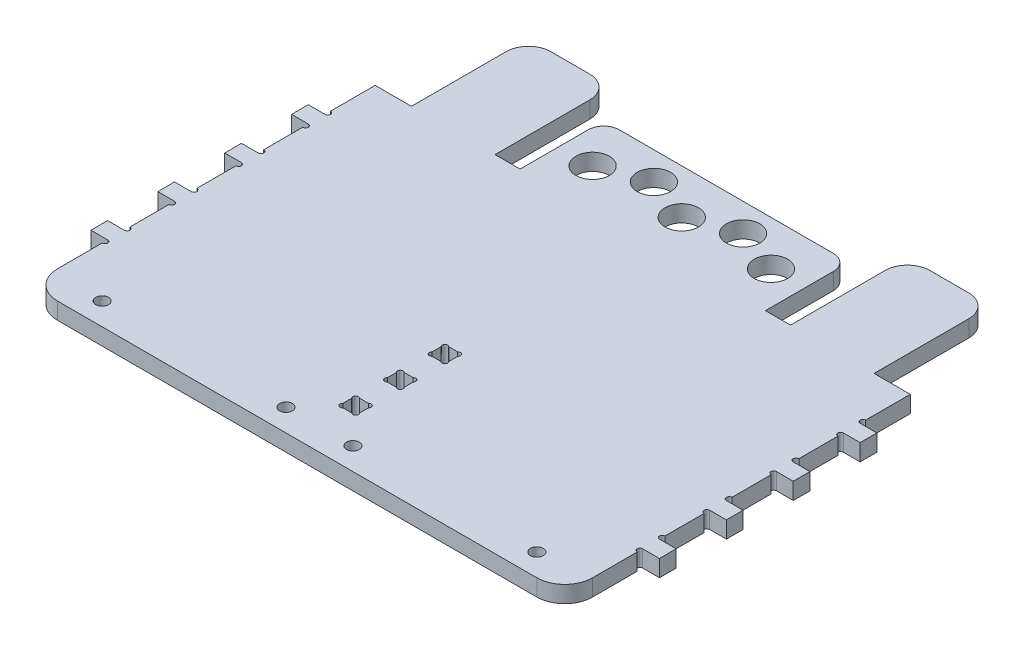
from build123d import *

# Parameters (mm, degrees)
SKETCH_S_R              = 7.3025
SKETCH_S_R_2            = 19.05
BOSS_EXTRUDE1_DEPTH     = 19.05
FILLET1_R               = 31.75
CUT_EXTRUDE1_DEPTH      = 778.557435178
CUT_EXTRUDE1_DEPTH_BACK = 778.557435178
SKETCH4_W               = 41.275
SKETCH4_H               = 19.05
SKETCH4_W_2             = 57.15
SKETCH4_W_3             = 28.575
CUT_EXTRUDE2_DEPTH      = 19.05
SKETCH5_W               = 95.25
SKETCH5_H               = 19.05
BOSS_EXTRUDE2_DEPTH     = 133.35
FILLET2_R               = 25.4


with BuildPart() as part:
    # Sketch s → Boss-Extrude1 (new body)
    with BuildSketch(Plane(origin=(0, 0, 0), x_dir=(1, 0, 0), z_dir=(0, 1, 0))):
        with BuildLine():
            Line((0, 50.8), (0, 0))
            Line((0, 0), (0, -31.75))
            Line((0, -31.75), (609.6, -31.75))
            Line((609.6, -31.75), (609.6, 0))
            Line((609.6, 0), (609.6, 50.8))
            ThreePointArc((609.6, 50.8), (606.425, 53.975), (609.6, 57.15))
            Line((609.6, 57.15), (628.65, 57.15))
            Line((628.65, 57.15), (628.65, 76.2))
            Line((628.65, 76.2), (609.6, 76.2))
            ThreePointArc((609.6, 76.2), (606.425, 79.375), (609.6, 82.55))
            Line((609.6, 82.55), (609.6, 127))
            ThreePointArc((609.6, 127), (606.425, 130.175), (609.6, 133.35))
            Line((609.6, 133.35), (628.65, 133.35))
            Line((628.65, 133.35), (628.65, 152.4))
            Line((628.65, 152.4), (609.6, 152.4))
            ThreePointArc((609.6, 152.4), (606.425, 155.575), (609.6, 158.75))
            Line((609.6, 158.75), (609.6, 203.2))
            ThreePointArc((609.6, 203.2), (606.425, 206.375), (609.6, 209.55))
            Line((609.6, 209.55), (628.65, 209.55))
            Line((628.65, 209.55), (628.65, 228.6))
            Line((628.65, 228.6), (609.6, 228.6))
            ThreePointArc((609.6, 228.6), (606.425, 231.775), (609.6, 234.95))
            Line((609.6, 234.95), (609.6, 279.4))
            ThreePointArc((609.6, 279.4), (606.425, 282.575), (609.6, 285.75))
            Line((609.6, 285.75), (628.65, 285.75))
            Line((628.65, 285.75), (628.65, 304.8))
            Line((628.65, 304.8), (609.6, 304.8))
            ThreePointArc((609.6, 304.8), (606.425, 307.975), (609.6, 311.15))
            Line((609.6, 311.15), (609.6, 381))
            Line((609.6, 381), (444.5, 381))
            Line((444.5, 381), (444.5, 439.42))
            ThreePointArc((444.5, 439.42), (439.292358569, 451.992358569), (426.72, 457.2))
            Line((426.72, 457.2), (304.8, 457.2))
            Line((304.8, 457.2), (182.88, 457.2))
            ThreePointArc((182.88, 457.2), (170.307641431, 451.992358569), (165.1, 439.42))
            Line((165.1, 439.42), (165.1, 381))
            Line((165.1, 381), (0, 381))
            Line((0, 381), (0, 311.15))
            ThreePointArc((0, 311.15), (3.175, 307.975), (0, 304.8))
            Line((0, 304.8), (-19.05, 304.8))
            Line((-19.05, 304.8), (-19.05, 285.75))
            Line((-19.05, 285.75), (0, 285.75))
            ThreePointArc((0, 285.75), (3.175, 282.575), (0, 279.4))
            Line((0, 279.4), (0, 234.95))
            ThreePointArc((0, 234.95), (3.175, 231.775), (0, 228.6))
            Line((0, 228.6), (-19.05, 228.6))
            Line((-19.05, 228.6), (-19.05, 209.55))
            Line((-19.05, 209.55), (0, 209.55))
            ThreePointArc((0, 209.55), (3.175, 206.375), (0, 203.2))
            Line((0, 203.2), (0, 158.75))
            ThreePointArc((0, 158.75), (3.175, 155.575), (0, 152.4))
            Line((0, 152.4), (-19.05, 152.4))
            Line((-19.05, 152.4), (-19.05, 133.35))
            Line((-19.05, 133.35), (0, 133.35))
            ThreePointArc((0, 133.35), (3.175, 130.175), (0, 127))
            Line((0, 127), (0, 82.55))
            ThreePointArc((0, 82.55), (3.175, 79.375), (0, 76.2))
            Line((0, 76.2), (-19.05, 76.2))
            Line((-19.05, 76.2), (-19.05, 57.15))
            Line((-19.05, 57.15), (0, 57.15))
            ThreePointArc((0, 57.15), (3.175, 53.975), (0, 50.8))
        make_face()
        with Locations(Location((57.15, -6.35, 0), (0, 0, 90))):
            Circle(SKETCH_S_R, mode=Mode.SUBTRACT)
        with Locations(Location((266.7, -6.35, 0), (0, 0, 90))):
            Circle(SKETCH_S_R, mode=Mode.SUBTRACT)
        with Locations(Location((342.9, -6.35, 0), (0, 0, 90))):
            Circle(SKETCH_S_R, mode=Mode.SUBTRACT)
        with Locations(Location((552.45, -6.35, 0), (0, 0, 90))):
            Circle(SKETCH_S_R, mode=Mode.SUBTRACT)
        with Locations(Location((203.2, 406.4, 0), (0, 0, 90))):
            Circle(SKETCH_S_R_2, mode=Mode.SUBTRACT)
        with Locations(Location((254, 425.45, 0), (0, 0, 90))):
            Circle(SKETCH_S_R_2, mode=Mode.SUBTRACT)
        with Locations(Location((304.8, 406.4, 0), (0, 0, 90))):
            Circle(SKETCH_S_R_2, mode=Mode.SUBTRACT)
        with Locations(Location((355.6, 425.45, 0), (0, 0, 90))):
            Circle(SKETCH_S_R_2, mode=Mode.SUBTRACT)
        with Locations(Location((406.4, 406.4, 0), (0, 0, 90))):
            Circle(SKETCH_S_R_2, mode=Mode.SUBTRACT)
    extrude(amount=BOSS_EXTRUDE1_DEPTH)

    # Fillet1
    fillet1_edges = [part.edges().sort_by_distance(p)[0] for p in [
        (609.6, 9.525, 31.75),
        (0, 9.525, 31.75),
    ]]
    fillet(fillet1_edges, radius=FILLET1_R)

    # Sketch3 → Cut-Extrude1 (cut, two sides: drawn at the far end of the back side and taken through both)
    with BuildSketch(Plane(origin=(0, 19.05, 0), x_dir=(1, 0, 0), z_dir=(0, 1, 0)).offset(-CUT_EXTRUDE1_DEPTH_BACK)):
        with BuildLine():
            Line((314.325, 131.490128061), (314.325, 141.559871939))
            ThreePointArc((314.325, 141.559871939), (314.325, 146.05), (309.834871939, 146.05))
            Line((309.834871939, 146.05), (299.765128061, 146.05))
            ThreePointArc((299.765128061, 146.05), (295.275, 146.05), (295.275, 141.559871939))
            Line((295.275, 141.559871939), (295.275, 131.490128061))
            ThreePointArc((295.275, 131.490128061), (295.275, 127), (299.765128061, 127))
            Line((299.765128061, 127), (309.834871939, 127))
            ThreePointArc((309.834871939, 127), (314.325, 127), (314.325, 131.490128061))
        make_face()
        with BuildLine():
            Line((314.325, 80.690128061), (314.325, 90.759871939))
            ThreePointArc((314.325, 90.759871939), (314.325, 95.25), (309.834871939, 95.25))
            Line((309.834871939, 95.25), (299.765128061, 95.25))
            ThreePointArc((299.765128061, 95.25), (295.275, 95.25), (295.275, 90.759871939))
            Line((295.275, 90.759871939), (295.275, 80.690128061))
            ThreePointArc((295.275, 80.690128061), (295.275, 76.2), (299.765128061, 76.2))
            Line((299.765128061, 76.2), (309.834871939, 76.2))
            ThreePointArc((309.834871939, 76.2), (314.325, 76.2), (314.325, 80.690128061))
        make_face()
        with BuildLine():
            Line((314.325, 29.890128061), (314.325, 39.959871939))
            ThreePointArc((314.325, 39.959871939), (314.325, 44.45), (309.834871939, 44.45))
            Line((309.834871939, 44.45), (299.765128061, 44.45))
            ThreePointArc((299.765128061, 44.45), (295.275, 44.45), (295.275, 39.959871939))
            Line((295.275, 39.959871939), (295.275, 29.890128061))
            ThreePointArc((295.275, 29.890128061), (295.275, 25.4), (299.765128061, 25.4))
            Line((299.765128061, 25.4), (309.834871939, 25.4))
            ThreePointArc((309.834871939, 25.4), (314.325, 25.4), (314.325, 29.890128061))
        make_face()
    extrude(amount=CUT_EXTRUDE1_DEPTH + CUT_EXTRUDE1_DEPTH_BACK, mode=Mode.SUBTRACT)

    # Sketch4 → Cut-Extrude2 (cut)
    with BuildSketch(Plane(origin=(0, 19.05, 0), x_dir=(1, 0, 0), z_dir=(0, 1, 0))):
        with Locations((20.6375, 371.475)):
            Rectangle(SKETCH4_W, SKETCH4_H)
        with Locations((88.9, 371.475)):
            Rectangle(SKETCH4_W_2, SKETCH4_H)
        with Locations((150.8125, 371.475)):
            Rectangle(SKETCH4_W_3, SKETCH4_H)
        with Locations((458.7875, 371.475)):
            Rectangle(SKETCH4_W_3, SKETCH4_H)
        with Locations((520.7, 371.475)):
            Rectangle(SKETCH4_W_2, SKETCH4_H)
        with Locations((588.9625, 371.475)):
            Rectangle(SKETCH4_W, SKETCH4_H)
    extrude(amount=-CUT_EXTRUDE2_DEPTH, mode=Mode.SUBTRACT)

    # Sketch5 → Boss-Extrude2 (add)
    with BuildSketch(Plane(origin=(0, 0, -361.95), x_dir=(-1, 0, 0), z_dir=(0, 0, -1))):
        with Locations((-520.7, 9.525)):
            Rectangle(SKETCH5_W, SKETCH5_H)
        with Locations((-88.9, 9.525)):
            Rectangle(SKETCH5_W, SKETCH5_H)
    extrude(amount=BOSS_EXTRUDE2_DEPTH)

    # Fillet2
    fillet2_edges = [part.edges().sort_by_distance(p)[0] for p in [
        (568.325, 9.525, -495.3),
        (473.075, 9.525, -495.3),
        (136.525, 9.525, -495.3),
        (41.275, 9.525, -495.3),
    ]]
    fillet(fillet2_edges, radius=FILLET2_R)


solid = part.part
